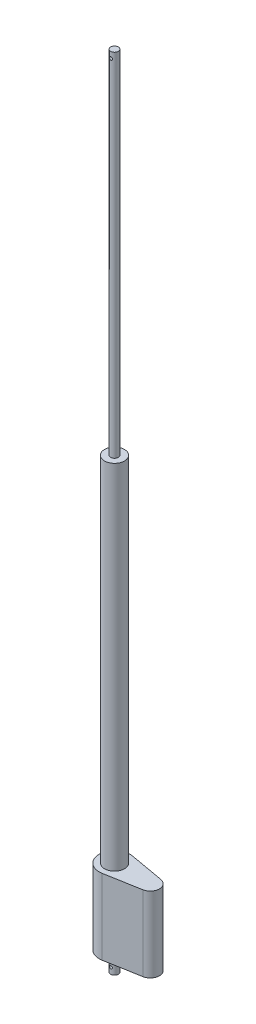
from build123d import *

# Parameters (mm, degrees)
CUT_EXTRUDE2_DEPTH      = 1034.387149136
CUT_EXTRUDE2_DEPTH_BACK = 1034.387149136
SKETCH8_R               = 2
BOSS_EXTRUDE4_DEPTH     = 98


with BuildPart() as part:
    # Sketch7 → Revolve2 (revolve)
    with BuildSketch(Plane(origin=(0, 0, 0), x_dir=(0, 0, -1), z_dir=(1, 0, 0))):
        Polygon((-20, 17), (-20, 115), (-13, 115), (-13, 575), (-5, 575), (-5, 1033), (0, 1033), (0, -8), (-5, -8), (-5, 17), align=None)
    revolve(axis=Axis((0, 1033, 0), (0, -1, 0)))

    # Sketch8 → Cut-Extrude2 (cut, two sides: drawn at the far end of the back side and taken through both)
    with BuildSketch(Plane.XY.offset(-CUT_EXTRUDE2_DEPTH_BACK)):
        with Locations((0, 1025)):
            Circle(SKETCH8_R)
        Circle(SKETCH8_R)
    extrude(amount=CUT_EXTRUDE2_DEPTH + CUT_EXTRUDE2_DEPTH_BACK, mode=Mode.SUBTRACT)

    # Sketch10 → Boss-Extrude4 (add)
    with BuildSketch(Plane(origin=(0, 115, 0), x_dir=(1, 0, 0), z_dir=(0, 1, 0))):
        with BuildLine():
            Line((3.491027189, 19.692961412), (48.629242089, 11.691181882))
            ThreePointArc((48.629242089, 11.691181882), (58.430175518, 0), (48.629242089, -11.691181882))
            Line((48.629242089, -11.691181882), (3.491027189, -19.692961412))
            ThreePointArc((3.491027189, -19.692961412), (-20, 0), (3.491027189, 19.692961412))
        make_face()
    extrude(amount=-BOSS_EXTRUDE4_DEPTH)


solid = part.part
